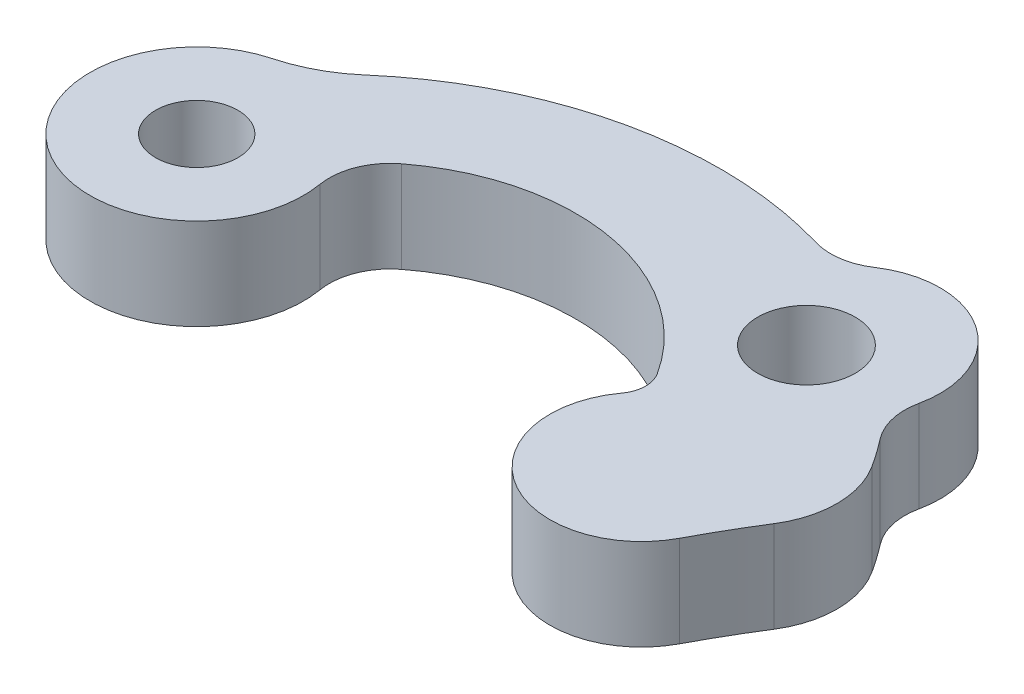
from build123d import *
from OCP.BRepFilletAPI import BRepFilletAPI_MakeFillet

# Parameters (mm, degrees)
SKETCH_1_R      = 1.35
SKETCH_1_R_2    = 1.6
EXTRUDE_1_DEPTH = 3
EXTRUDE_START   = -3
SKETCH_3_R      = 3.5
SKETCH_3_R_2    = 1.35
EXTRUDE_3_DEPTH = 3
FILLET_2_R1     = 5
FILLET_2_R2     = 2
FILLET_2_R3     = 1
FILLET_2_R4     = 30
EXTRUDE_4_DEPTH = 3
FILLET_3_R      = 2


with BuildPart() as part:
    # 草图1 → 凸台-拉伸1 (new body)
    # profile 1 of 2: a face of its own
    with BuildSketch(Plane(origin=(0, 0, 0), x_dir=(1, 0, 0), z_dir=(0, 1, 0))):
        with BuildLine():
            ThreePointArc((20.525, 1.619992284), (9.210909522, 7.594690029), (-1.742424242, 0.981813505))
            ThreePointArc((-1.742424242, 0.981813505), (-0.831280947, -1.819057994), (1.882716049, -0.6748187))
            ThreePointArc((1.882716049, -0.6748187), (8.068871386, 3.95168534), (14.746234429, 0.067630724))
            ThreePointArc((14.746234429, 0.067630724), (14.962422497, -0.414223398), (15.141666667, -0.911005245))
            ThreePointArc((15.141666667, -0.911005245), (17.049420643, -2.845417172), (19.736805453, -2.446120769))
            ThreePointArc((19.736805453, -2.446120769), (20.945176611, -0.570906936), (20.525, 1.619992284))
        make_face()
        with Locations(Location((0, 0, 0), (0, 0, 270))):
            Circle(SKETCH_1_R, mode=Mode.SUBTRACT)
        with Locations(Location((16, 4, 0), (0, 0, 270))):
            Circle(SKETCH_1_R_2, mode=Mode.SUBTRACT)
    # profile 2 of 2: a face of its own
    with BuildSketch(Plane(origin=(0, 0, 0), x_dir=(1, 0, 0), z_dir=(0, 1, 0))):
        with BuildLine():
            ThreePointArc((15.141666667, -0.911005245), (14.962422497, -0.414223398), (14.746234429, 0.067630724))
            ThreePointArc((14.746234429, 0.067630724), (15.400433961, -4.844367805), (19.736805453, -2.446120769))
            ThreePointArc((19.736805453, -2.446120769), (17.049420643, -2.845417172), (15.141666667, -0.911005245))
        make_face()
    extrude(amount=EXTRUDE_1_DEPTH)

    # 草图3 → 凸台-拉伸3 (add)
    with BuildSketch(Plane(origin=(0, 3, 0), x_dir=(1, 0, 0), z_dir=(0, 1, 0)).offset(EXTRUDE_START)):
        Circle(SKETCH_3_R)
        with Locations(Location((0, 0, 0), (0, 0, 270))):
            Circle(SKETCH_3_R_2, mode=Mode.SUBTRACT)
    extrude(amount=EXTRUDE_3_DEPTH)

    # 圆角2: one fillet with a radius per group of edges: ONE call of the kernel's fillet builder (fillet() takes one radius for all edges)
    fillet_2_edges_1 = [part.edges().sort_by_distance(p)[0] for p in [
        (0.106041749, 1.5, -3.498393224),
    ]]
    fillet_2_edges_2 = [part.edges().sort_by_distance(p)[0] for p in [
        (3.154761182, 1.5, -1.515744663),
    ]]
    fillet_2_edges_3 = [part.edges().sort_by_distance(p)[0] for p in [
        (14.746234429, 1.5, -0.067630724),
    ]]
    fillet_2_edges_4 = [part.edges().sort_by_distance(p)[0] for p in [
        (19.736805453, 1.5, 2.446120769),
    ]]
    fillet_2 = BRepFilletAPI_MakeFillet(part.part.solid().wrapped)
    for e in fillet_2_edges_1:
        fillet_2.Add(FILLET_2_R1, e.wrapped)
    for e in fillet_2_edges_2:
        fillet_2.Add(FILLET_2_R2, e.wrapped)
    for e in fillet_2_edges_3:
        fillet_2.Add(FILLET_2_R3, e.wrapped)
    for e in fillet_2_edges_4:
        fillet_2.Add(FILLET_2_R4, e.wrapped)
    add(Compound.cast(fillet_2.Shape()), mode=Mode.REPLACE)

    # 草图4 → 凸台-拉伸4 (add)
    with BuildSketch(Plane(origin=(0, 3, 0), x_dir=(1, 0, 0), z_dir=(0, 1, 0)).offset(EXTRUDE_START)):
        with BuildLine():
            ThreePointArc((19.184075551, 3.365055605), (16.912631767, 5.336942618), (14.2487975, 6.734004627))
            ThreePointArc((14.2487975, 6.734004627), (18.255168749, 7.303666738), (19.184075551, 3.365055605))
        make_face()
    extrude(amount=EXTRUDE_4_DEPTH)

    # 圆角3
    fillet_3_edges = [part.edges().sort_by_distance(p)[0] for p in [
        (14.2487975, 1.5, -6.734004627),
        (19.184075551, 1.5, -3.365055605),
    ]]
    fillet(fillet_3_edges, radius=FILLET_3_R)


solid = part.part
